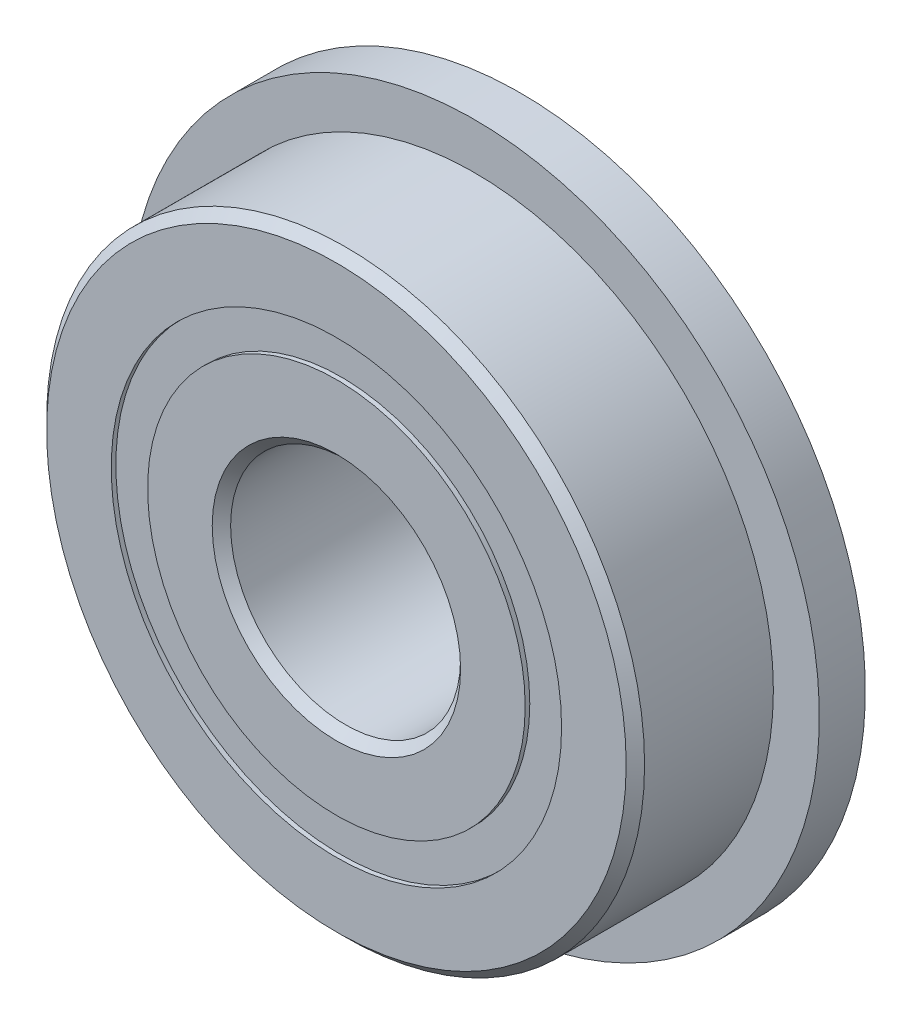
from build123d import *

# Parameters (mm, degrees)
CIRPATTERN1_COUNT = 12
SKETCH5_W         = 0.927052779
SKETCH5_H         = 0.791208792
SKETCH6_W         = 1
SKETCH6_H         = 2.604395604


with BuildPart() as part:
    # Sketch1 → Revolve1 (revolve)
    with BuildSketch(Plane(origin=(0, 0, 0), x_dir=(0, 0, -1), z_dir=(1, 0, 0))):
        with BuildLine():
            Line((1.8, 6.5), (-1.8, 6.5))
            Line((-1.8, 6.5), (-2, 6.3))
            Line((-2, 6.3), (-2, 4.895604396))
            Line((-2, 4.895604396), (-0.888888889, 4.895604396))
            ThreePointArc((-0.888888889, 4.895604396), (0, 5.472947221), (0.888888889, 4.895604396))
            Line((0.888888889, 4.895604396), (2, 4.895604396))
            Line((2, 4.895604396), (2, 6.3))
            Line((2, 6.3), (1.8, 6.5))
        make_face()
    revolve(axis=Axis((0, 0, 2), (0, 0, -1)))

    # Sketch6 → Revolve6 (revolve)
    with BuildSketch(Plane(origin=(0, 0, 0), x_dir=(0, 0, -1), z_dir=(1, 0, 0))):
        with Locations((1.5, 6.197802198)):
            Rectangle(SKETCH6_W, SKETCH6_H)
    revolve(axis=Axis((0, 0, -2), (0, 0, 1)))


with BuildPart() as body_2:
    # Sketch3 → Revolve3 (revolve)
    with BuildSketch(Plane(origin=(0, 0, 0), x_dir=(0, 0, -1), z_dir=(1, 0, 0))):
        with BuildLine():
            Line((-2, 4.104395604), (-0.888888889, 4.104395604))
            ThreePointArc((-0.888888889, 4.104395604), (0, 3.527052779), (0.888888889, 4.104395604))
            Line((0.888888889, 4.104395604), (2, 4.104395604))
            Line((2, 4.104395604), (2, 2.7))
            Line((2, 2.7), (1.8, 2.5))
            Line((1.8, 2.5), (-1.8, 2.5))
            Line((-1.8, 2.5), (-2, 2.7))
            Line((-2, 2.7), (-2, 4.104395604))
        make_face()
    revolve(axis=Axis((0, 0, 2), (0, 0, -1)))


with BuildPart() as body_3:
    # Sketch4 → Revolve4 (revolve)
    with BuildSketch(Plane(origin=(0, 0, 0), x_dir=(0, 0, -1), z_dir=(1, 0, 0))):
        with BuildLine():
            Line((-0.972947221, 4.5), (0.972947221, 4.5))
            ThreePointArc((0.972947221, 4.5), (0, 5.472947221), (-0.972947221, 4.5))
        make_face()
    revolve(axis=Axis((0, 4.5, 0.972947221), (0, 0, -1)))


with BuildPart() as cirpattern1_1:
    # CirPattern1: pattern copy
    add(body_3.part.rotate(Axis((0, 0, -2), (0, 0, 1)), 1 * 360 / CIRPATTERN1_COUNT))


with BuildPart() as cirpattern1_2:
    # CirPattern1: pattern copy
    add(body_3.part.rotate(Axis((0, 0, -2), (0, 0, 1)), 2 * 360 / CIRPATTERN1_COUNT))


with BuildPart() as cirpattern1_3:
    # CirPattern1: pattern copy
    add(body_3.part.rotate(Axis((0, 0, -2), (0, 0, 1)), 3 * 360 / CIRPATTERN1_COUNT))


with BuildPart() as cirpattern1_4:
    # CirPattern1: pattern copy
    add(body_3.part.rotate(Axis((0, 0, -2), (0, 0, 1)), 4 * 360 / CIRPATTERN1_COUNT))


with BuildPart() as cirpattern1_5:
    # CirPattern1: pattern copy
    add(body_3.part.rotate(Axis((0, 0, -2), (0, 0, 1)), 5 * 360 / CIRPATTERN1_COUNT))


with BuildPart() as cirpattern1_6:
    # CirPattern1: pattern copy
    add(body_3.part.rotate(Axis((0, 0, -2), (0, 0, 1)), 6 * 360 / CIRPATTERN1_COUNT))


with BuildPart() as cirpattern1_7:
    # CirPattern1: pattern copy
    add(body_3.part.rotate(Axis((0, 0, -2), (0, 0, 1)), 7 * 360 / CIRPATTERN1_COUNT))


with BuildPart() as cirpattern1_8:
    # CirPattern1: pattern copy
    add(body_3.part.rotate(Axis((0, 0, -2), (0, 0, 1)), 8 * 360 / CIRPATTERN1_COUNT))


with BuildPart() as cirpattern1_9:
    # CirPattern1: pattern copy
    add(body_3.part.rotate(Axis((0, 0, -2), (0, 0, 1)), 9 * 360 / CIRPATTERN1_COUNT))


with BuildPart() as cirpattern1_10:
    # CirPattern1: pattern copy
    add(body_3.part.rotate(Axis((0, 0, -2), (0, 0, 1)), 10 * 360 / CIRPATTERN1_COUNT))


with BuildPart() as cirpattern1_11:
    # CirPattern1: pattern copy
    add(body_3.part.rotate(Axis((0, 0, -2), (0, 0, 1)), 11 * 360 / CIRPATTERN1_COUNT))


with BuildPart() as body_15:
    # Sketch5 → Revolve5 (revolve)
    with BuildSketch(Plane(origin=(0, 0, 0), x_dir=(0, 0, -1), z_dir=(1, 0, 0))):
        with Locations((-1.436473611, 4.5)):
            Rectangle(SKETCH5_W, SKETCH5_H)
        with Locations((1.436473611, 4.5)):
            Rectangle(SKETCH5_W, SKETCH5_H)
    revolve(axis=Axis((0, 0, 2), (0, 0, -1)))


solid = Compound([part.part, body_2.part, body_3.part, cirpattern1_1.part, cirpattern1_2.part, cirpattern1_3.part, cirpattern1_4.part, cirpattern1_5.part, cirpattern1_6.part, cirpattern1_7.part, cirpattern1_8.part, cirpattern1_9.part, cirpattern1_10.part, cirpattern1_11.part, body_15.part])
